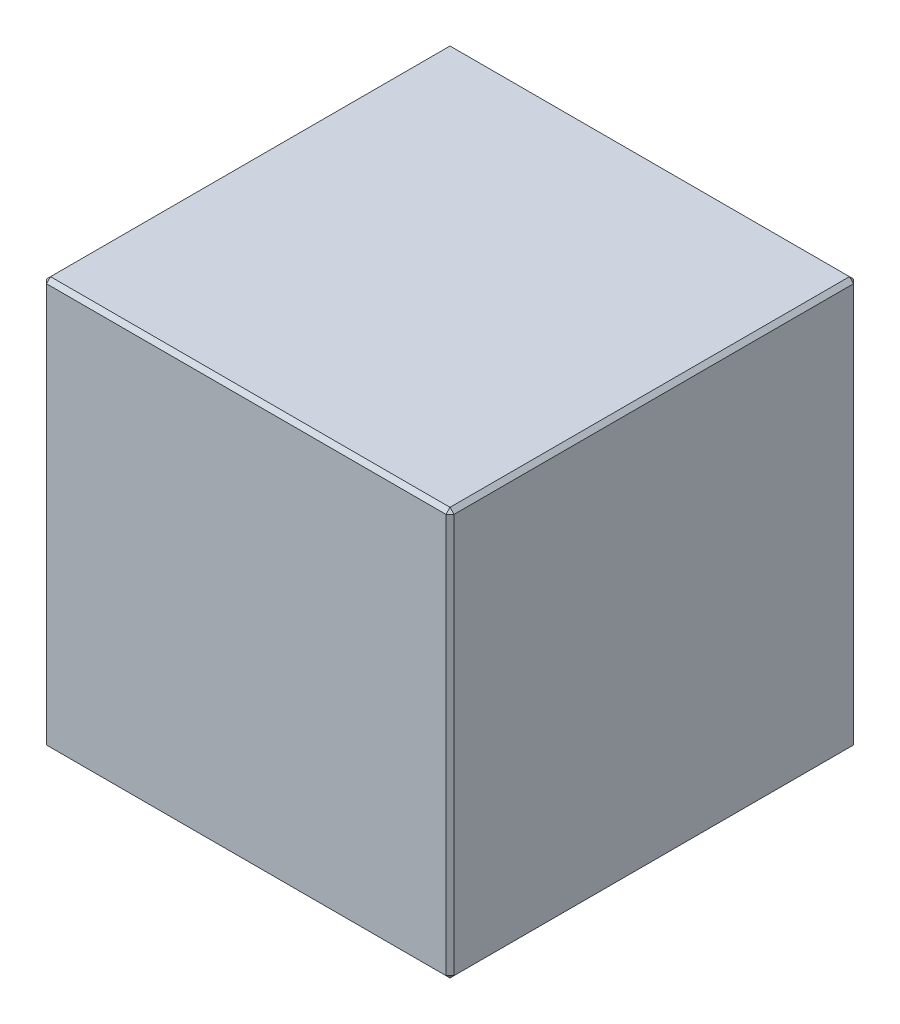
from build123d import *

# Parameters (mm, degrees)
SKETCH1_W           = 60
SKETCH1_H           = 60
BOSS_EXTRUDE1_DEPTH = 60
CHAMFER1_SIZE       = 0.6


with BuildPart() as part:
    # Sketch1 → Boss-Extrude1 (new body)
    with BuildSketch(Plane(origin=(0, 0, 0), x_dir=(1, 0, 0), z_dir=(0, 1, 0))):
        with Locations((30, 30)):
            Rectangle(SKETCH1_W, SKETCH1_H)
    extrude(amount=BOSS_EXTRUDE1_DEPTH)

    # Chamfer1
    chamfer1_edges = [part.edges().sort_by_distance(p)[0] for p in [
        (60, 0, -30),
        (0, 0, -30),
        (60, 60, -30),
        (60, 30, -60),
        (30, 60, -60),
        (30, 0, -60),
        (0, 30, -60),
        (0, 60, -30),
        (0, 30, 0),
        (30, 60, 0),
        (60, 30, 0),
        (30, 0, 0),
    ]]
    chamfer(chamfer1_edges, length=CHAMFER1_SIZE)


solid = part.part
